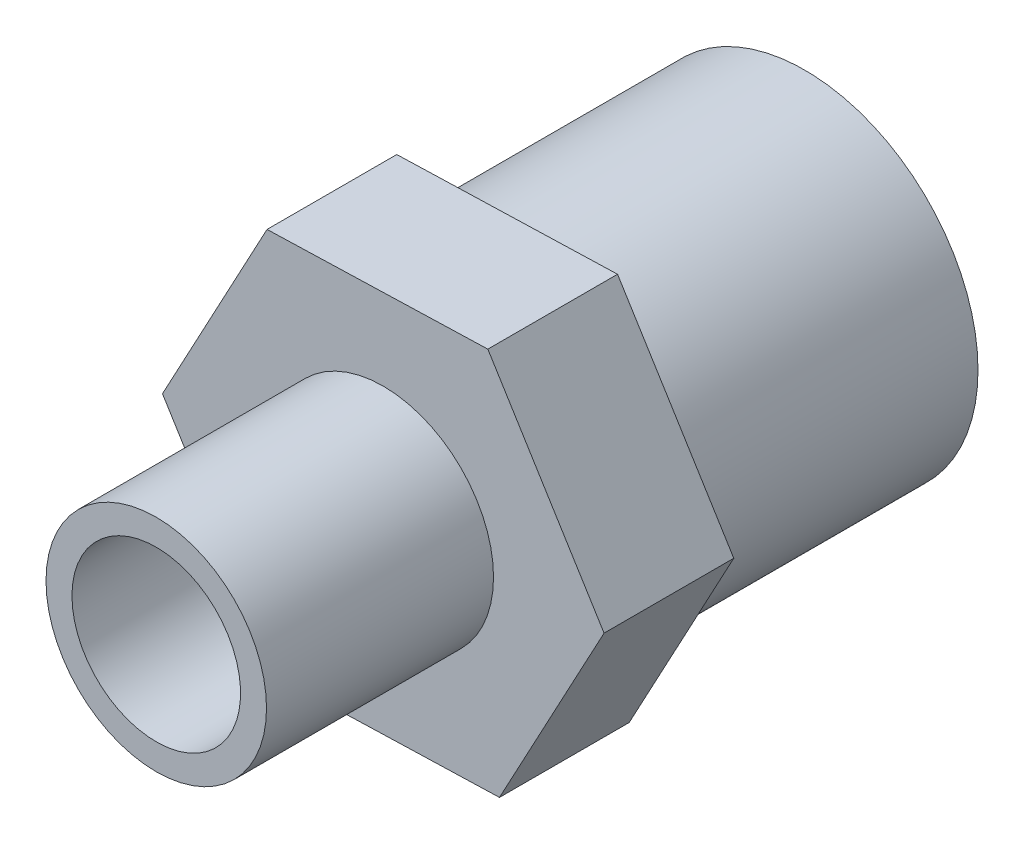
from build123d import *

# Parameters (mm, degrees)
SKETCH1_R           = 8.5
SKETCH1_R_2         = 6.5
EXTRUDE_THIN1_DEPTH = 22.5
BOSS_EXTRUDE1_DEPTH = 5
SKETCH3_R           = 13.35
SKETCH3_R_2         = 10.65
EXTRUDE_THIN2_DEPTH = 22.5


with BuildPart() as part:
    # Sketch1 → Extrude-Thin1 (new body)
    with BuildSketch(Plane.XY):
        Circle(SKETCH1_R)
        Circle(SKETCH1_R_2, mode=Mode.SUBTRACT)
    extrude(amount=EXTRUDE_THIN1_DEPTH)

    # Sketch2 → Boss-Extrude1 (add, symmetric)
    with BuildSketch(Plane.XY):
        Polygon((17.021487729, 0.517918433), (8.062213344, 15), (-8.959274385, 14.482081567), (-17.021487729, -0.517918433), (-8.062213344, -15), (8.959274385, -14.482081567), align=None)
    extrude(amount=BOSS_EXTRUDE1_DEPTH, both=True)

    # Sketch3 → Extrude-Thin2 (add)
    with BuildSketch(Plane(origin=(0, 0, -5), x_dir=(-1, 0, 0), z_dir=(0, 0, -1))):
        Circle(SKETCH3_R)
        Circle(SKETCH3_R_2, mode=Mode.SUBTRACT)
    extrude(amount=EXTRUDE_THIN2_DEPTH)


solid = part.part
